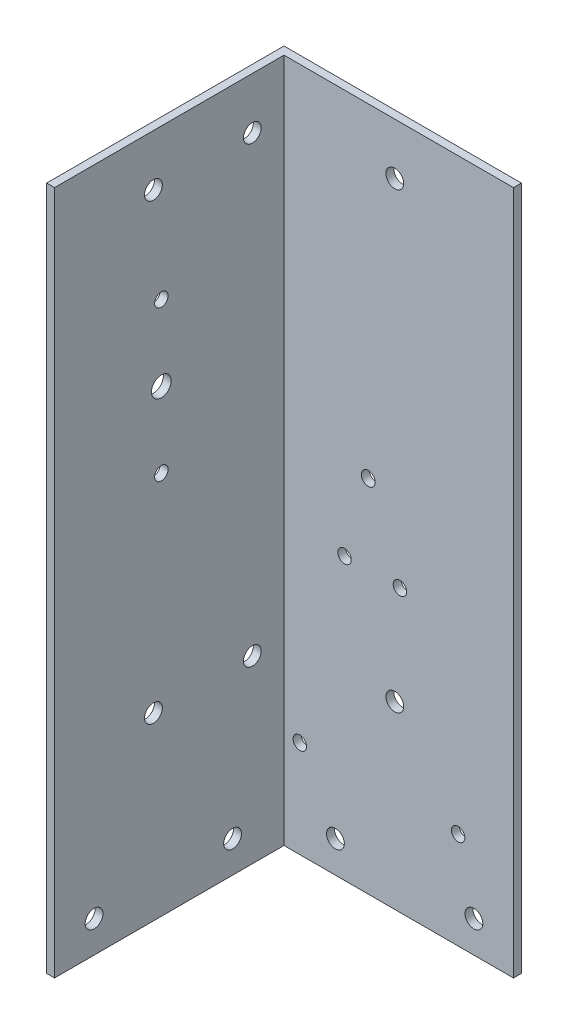
from build123d import *

# Parameters (mm, degrees)
LINEAR_AUSTRAGEN_D_NN1_DEPTH     = 173
DURCHGANGSLOCH_F_R_M41_D         = 4.5
DURCHGANGSLOCH_F_R_M42_D         = 4.5
DURCHGANGSLOCH_F_R_M43_D         = 4.5
DURCHGANGSLOCH_F_R_M31_D         = 3.4
F_5_0_5_DURCHMESSER_BOHRUNG1_D   = 5
DURCHGANGSLOCH_F_R_M32_D         = 3.4
DURCHGANGSLOCH_F_R_M33_D         = 3.4
F_3_5_3_5_DURCHMESSER_BOHRUNG1_D = 3.5


with BuildPart() as part:
    # Skizze1 → Linear-Austragen-Dünn1 (new body)
    with BuildSketch(Plane(origin=(0, 0, 0), x_dir=(1, 0, 0), z_dir=(0, 1, 0))):
        Polygon((60, 0), (0, 0), (0, -60), (2, -60), (2, -2), (60, -2), align=None)
    extrude(amount=LINEAR_AUSTRAGEN_D_NN1_DEPTH)

    # Durchgangsloch für M41 (through all)
    with Locations(Plane.ZY):
        with Locations((35, 160), (10, 160)):
            Hole(DURCHGANGSLOCH_F_R_M41_D / 2)

    # Durchgangsloch für M42 (through all)
    with Locations(Plane.ZY):
        with Locations((35, 45.5), (10, 45.5), (50, 8), (15, 8)):
            Hole(DURCHGANGSLOCH_F_R_M42_D / 2)

    # Durchgangsloch für M43 (through all)
    with Locations(Plane(origin=(0, 0, 0), x_dir=(-1, 0, 0), z_dir=(0, 0, -1))):
        with Locations((-30, 45.5), (-50, 8), (-15, 8), (-30, 160)):
            Hole(DURCHGANGSLOCH_F_R_M43_D / 2)

    # Durchgangsloch für M31 (through all)
    with Locations(Plane.ZY):
        with Locations((33, 97), (33, 135)):
            Hole(DURCHGANGSLOCH_F_R_M31_D / 2)

    # Ø5.0 (5) Durchmesser Bohrung1 (through all)
    with Locations(Plane.ZY):
        with Locations((33, 116)):
            Hole(F_5_0_5_DURCHMESSER_BOHRUNG1_D / 2)

    # Durchgangsloch für M32 (through all)
    with Locations(Plane(origin=(0, 0, 0), x_dir=(-1, 0, 0), z_dir=(0, 0, -1))):
        with Locations((-31.299999687, 71), (-17.299999687, 71)):
            Hole(DURCHGANGSLOCH_F_R_M32_D / 2)

    # Durchgangsloch für M33 (through all)
    with Locations(Plane(origin=(0, 0, 0), x_dir=(-1, 0, 0), z_dir=(0, 0, -1))):
        with Locations((-46, 24.5), (-6, 24.5)):
            Hole(DURCHGANGSLOCH_F_R_M33_D / 2)

    # Ø3.5 (3.5) Durchmesser Bohrung1 (through all)
    with Locations(Plane(origin=(0, 0, 0), x_dir=(-1, 0, 0), z_dir=(0, 0, -1))):
        with Locations((-23.299999687, 91)):
            Hole(F_3_5_3_5_DURCHMESSER_BOHRUNG1_D / 2)


solid = part.part
